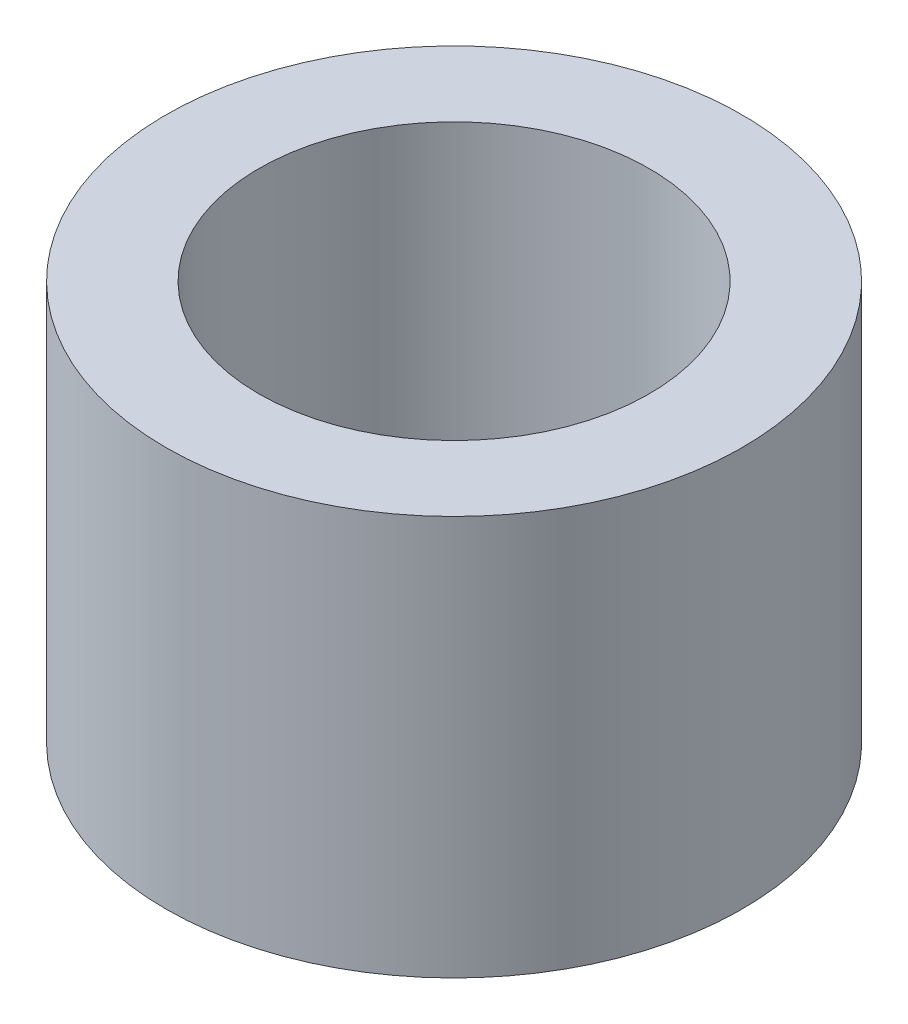
from build123d import *

# Parameters (mm, degrees)
SKETCH1_R           = 3.937
SKETCH1_R_2         = 2.667
BOSS_EXTRUDE1_DEPTH = 5.461


with BuildPart() as part:
    # Sketch1 → Boss-Extrude1 (new body)
    with BuildSketch(Plane(origin=(0, 0, 0), x_dir=(1, 0, 0), z_dir=(0, 1, 0))):
        with Locations(Location((0, 0, 0), (0, 0, 270))):
            Circle(SKETCH1_R)
        with Locations(Location((0, 0, 0), (0, 0, 270))):
            Circle(SKETCH1_R_2, mode=Mode.SUBTRACT)
    extrude(amount=BOSS_EXTRUDE1_DEPTH)


solid = part.part
